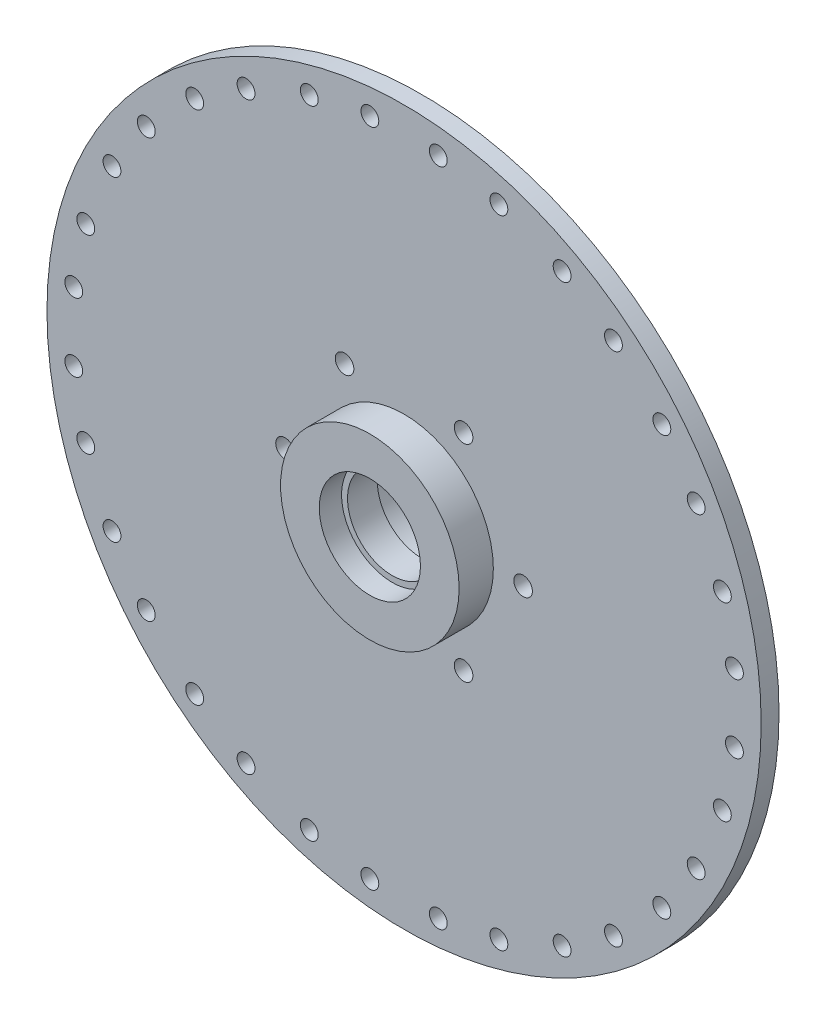
from build123d import *

# Parameters (mm, degrees)
SCHIZZO1_R                   = 240
SCHIZZO1_R_2                 = 6.25
ESTRUSIONE_ESTRUSIONE1_DEPTH = 12
SCHIZZO2_R                   = 60
ESTRUSIONE_ESTRUSIONE2_DEPTH = 23
SCHIZZO3_R                   = 67.5
ESTRUSIONE_ESTRUSIONE3_DEPTH = 15
SCHIZZO4_R                   = 34
TAGLIO_ESTRUSIONE1_DEPTH     = 15
SCHIZZO5_R                   = 30
TAGLIO_ESTRUSIONE2_DEPTH     = 20
TAGLIO_ESTRUSIONE3_START     = -15
SCHIZZO6_R                   = 34
TAGLIO_ESTRUSIONE3_DEPTH     = 15
SCHIZZO7_R                   = 6
TAGLIO_ESTRUSIONE4_DEPTH     = 12
RIPETIZIONECIRCOLARE1_COUNT  = 16


with BuildPart() as part:
    # Schizzo1 → Estrusione-Estrusione1 (new body)
    with BuildSketch(Plane.XY):
        Circle(SCHIZZO1_R)
        with Locations((-40, -69.282032303)):
            Circle(SCHIZZO1_R_2, mode=Mode.SUBTRACT)
        with Locations((40, -69.282032303)):
            Circle(SCHIZZO1_R_2, mode=Mode.SUBTRACT)
        with Locations((80, 0)):
            Circle(SCHIZZO1_R_2, mode=Mode.SUBTRACT)
        with Locations((40, 69.282032303)):
            Circle(SCHIZZO1_R_2, mode=Mode.SUBTRACT)
        with Locations((-40, 69.282032303)):
            Circle(SCHIZZO1_R_2, mode=Mode.SUBTRACT)
        with Locations((-80, 0)):
            Circle(SCHIZZO1_R_2, mode=Mode.SUBTRACT)
    extrude(amount=ESTRUSIONE_ESTRUSIONE1_DEPTH)

    # Schizzo2 → Estrusione-Estrusione2 (add)
    with BuildSketch(Plane.XY.offset(12)):
        Circle(SCHIZZO2_R)
    extrude(amount=ESTRUSIONE_ESTRUSIONE2_DEPTH)

    # Schizzo3 → Estrusione-Estrusione3 (add)
    with BuildSketch(Plane(origin=(0, 0, 0), x_dir=(-1, 0, 0), z_dir=(0, 0, -1))):
        with Locations(Location((0, 0, 0), (0, 0, 180))):
            Circle(SCHIZZO3_R)
    extrude(amount=ESTRUSIONE_ESTRUSIONE3_DEPTH)

    # Schizzo4 → Taglio-Estrusione1 (cut)
    with BuildSketch(Plane.XY.offset(35)):
        Circle(SCHIZZO4_R)
    extrude(amount=-TAGLIO_ESTRUSIONE1_DEPTH, mode=Mode.SUBTRACT)

    # Schizzo5 → Taglio-Estrusione2 (cut)
    with BuildSketch(Plane.XY.offset(20)):
        Circle(SCHIZZO5_R)
    extrude(amount=-TAGLIO_ESTRUSIONE2_DEPTH, mode=Mode.SUBTRACT)

    # Schizzo6 → Taglio-Estrusione3 (cut)
    with BuildSketch(Plane(origin=(0, 0, -15), x_dir=(-1, 0, 0), z_dir=(0, 0, -1)).offset(TAGLIO_ESTRUSIONE3_START)):
        with Locations(Location((0, 0, 0), (0, 0, 180))):
            Circle(SCHIZZO6_R)
    extrude(amount=TAGLIO_ESTRUSIONE3_DEPTH, mode=Mode.SUBTRACT)

    # Schizzo7 → Taglio-Estrusione4 (cut)
    with BuildSketch(Plane.XY.offset(12)):
        with Locations((-222, 23)):
            Circle(SCHIZZO7_R)
        with Locations((-222, -23)):
            Circle(SCHIZZO7_R)
    taglio_estrusione4 = extrude(amount=-TAGLIO_ESTRUSIONE4_DEPTH, mode=Mode.SUBTRACT)

    # RipetizioneCircolare1: Taglio-Estrusione4 ×16 about axis
    ripetizionecircolare1_axis = Axis((0, 0, 0), (0, 0, 1))
    for i in range(1, RIPETIZIONECIRCOLARE1_COUNT):
        add(taglio_estrusione4.rotate(ripetizionecircolare1_axis, i * 360 / RIPETIZIONECIRCOLARE1_COUNT), mode=Mode.SUBTRACT)


solid = part.part
